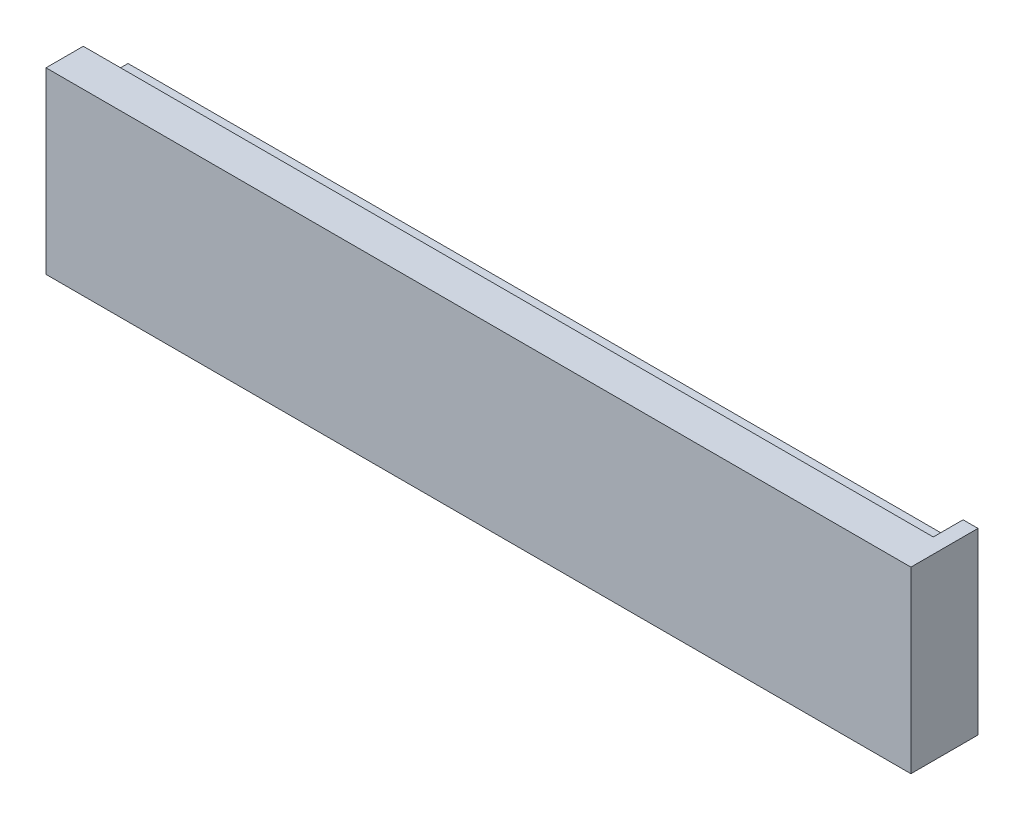
from build123d import *

# Parameters (mm, degrees)
BOSS_EXTRUDE1_DEPTH = 144.78
SKETCH2_W           = 30.48
SKETCH2_H           = 11.43
BOSS_EXTRUDE2_DEPTH = 2.54


with BuildPart() as part:
    # Sketch1 → Boss-Extrude1 (new body)
    with BuildSketch(Plane.YZ):
        Polygon((0, 0), (17.78, 0), (17.78, 7.62), (24.13, 7.62), (24.13, 13.97), (17.78, 13.97), (0, 13.97), (-6.35, 13.97), (-6.35, 7.62), (0, 7.62), align=None)
    extrude(amount=BOSS_EXTRUDE1_DEPTH)

    # Sketch2 → Boss-Extrude2 (add)
    with BuildSketch(Plane.YZ.offset(144.78)):
        with Locations((8.89, 8.255)):
            Rectangle(SKETCH2_W, SKETCH2_H)
    extrude(amount=BOSS_EXTRUDE2_DEPTH)


solid = part.part
